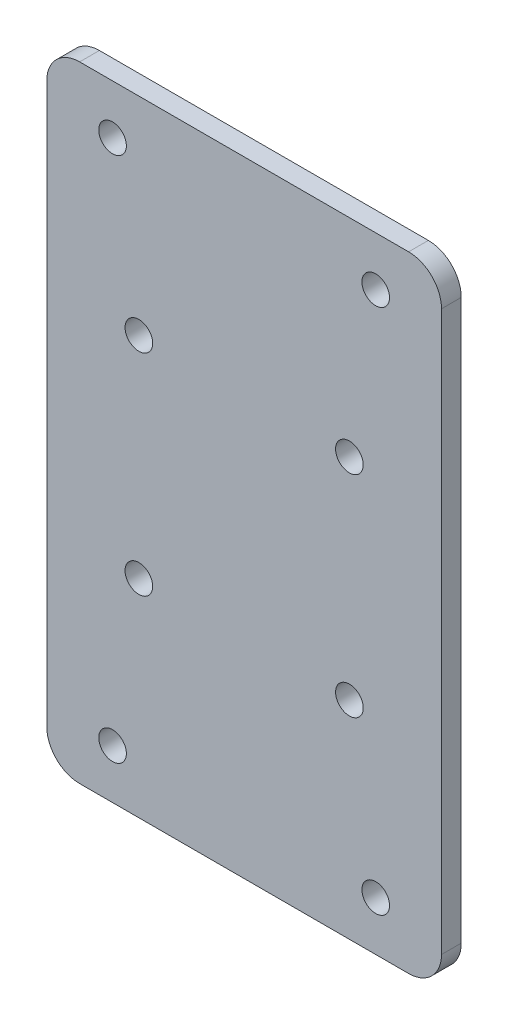
from build123d import *

# Parameters (mm, degrees)
SKETCH_1_W      = 60
SKETCH_1_H      = 95
SKETCH_1_R      = 2.1
EXTRUDE_1_DEPTH = 3
FILLET_1_R      = 5


with BuildPart() as part:
    # ｽｹｯﾁ1 → ﾎﾞｽ - 押し出し1 (new body)
    with BuildSketch(Plane.XY):
        Rectangle(SKETCH_1_W, SKETCH_1_H)
        with Locations((-16, 16)):
            Circle(SKETCH_1_R, mode=Mode.SUBTRACT)
        with Locations((16, 16)):
            Circle(SKETCH_1_R, mode=Mode.SUBTRACT)
        with Locations((-16, -16)):
            Circle(SKETCH_1_R, mode=Mode.SUBTRACT)
        with Locations((16, -16)):
            Circle(SKETCH_1_R, mode=Mode.SUBTRACT)
        with Locations((-20, 40)):
            Circle(SKETCH_1_R, mode=Mode.SUBTRACT)
        with Locations((-20, -40)):
            Circle(SKETCH_1_R, mode=Mode.SUBTRACT)
        with Locations((20, 40)):
            Circle(SKETCH_1_R, mode=Mode.SUBTRACT)
        with Locations((20, -40)):
            Circle(SKETCH_1_R, mode=Mode.SUBTRACT)
    extrude(amount=EXTRUDE_1_DEPTH)

    # ﾌｨﾚｯﾄ1
    fillet_1_edges = [part.edges().sort_by_distance(p)[0] for p in [
        (30, -47.5, 1.5),
        (-30, -47.5, 1.5),
        (-30, 47.5, 1.5),
        (30, 47.5, 1.5),
    ]]
    fillet(fillet_1_edges, radius=FILLET_1_R)


solid = part.part
